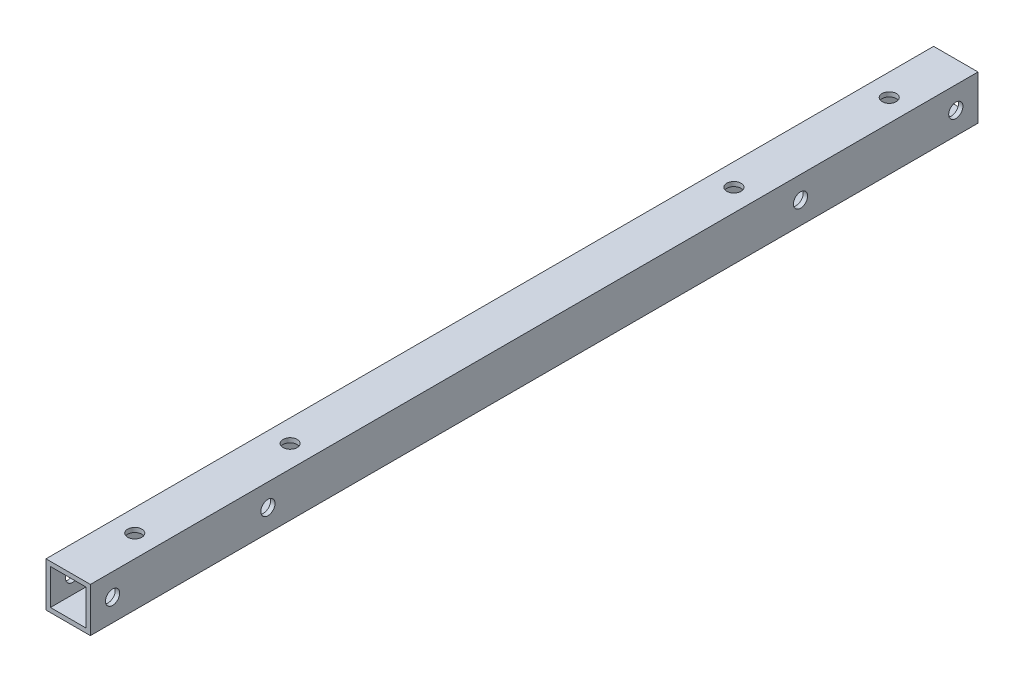
from build123d import *

# Parameters (mm, degrees)
SKETCH_1_W               = 10
SKETCH_1_H               = 10
SKETCH_1_W_2             = 8
SKETCH_1_H_2             = 8
EXTRUDE_1_DEPTH          = 200
CUT_EXTRUDE_1_DEPTH      = 201.31225624
CUT_EXTRUDE_1_DEPTH_BACK = 201.31225624
SKETCH_2_R               = 1.6
SKETCH_3_R               = 1.6
CUT_EXTRUDE_2_DEPTH      = 201.31225624
SKETCH_4_R               = 1.6
CUT_EXTRUDE_3_DEPTH      = 201.31225624


with BuildPart() as part:
    # ｽｹｯﾁ1 → ﾎﾞｽ - 押し出し1 (new body)
    with BuildSketch(Plane.XY):
        Rectangle(SKETCH_1_W, SKETCH_1_H)
        Rectangle(SKETCH_1_W_2, SKETCH_1_H_2, mode=Mode.SUBTRACT)
    extrude(amount=EXTRUDE_1_DEPTH)

    # ｽｹｯﾁ2 → ｶｯﾄ - 押し出し1 (cut, two sides: drawn at the far end of the back side and taken through both)
    with BuildSketch(Plane(origin=(5, 0, 0), x_dir=(0, 0, -1), z_dir=(1, 0, 0)).offset(-CUT_EXTRUDE_1_DEPTH_BACK)):
        with Locations(Location((-160, 0, 0), (0, 0, 90))):
            Circle(SKETCH_2_R)
        with Locations(Location((-40, 0, 0), (0, 0, 90))):
            Circle(SKETCH_2_R)
        with Locations(Location((-195, 0, 0), (0, 0, 90))):
            Circle(SKETCH_2_R)
        with Locations(Location((-5, 0, 0), (0, 0, 90))):
            Circle(SKETCH_2_R)
    extrude(amount=CUT_EXTRUDE_1_DEPTH + CUT_EXTRUDE_1_DEPTH_BACK, mode=Mode.SUBTRACT)

    # ｽｹｯﾁ3 → ｶｯﾄ - 押し出し2 (cut, through all)
    with BuildSketch(Plane(origin=(0, 5, 0), x_dir=(1, 0, 0), z_dir=(0, 1, 0))):
        with Locations(Location((0, -185, 0), (0, 0, 270))):
            Circle(SKETCH_3_R)
        with Locations(Location((0, -15, 0), (0, 0, 270))):
            Circle(SKETCH_3_R)
    extrude(amount=-CUT_EXTRUDE_2_DEPTH, mode=Mode.SUBTRACT)

    # ｽｹｯﾁ4 → ｶｯﾄ - 押し出し3 (cut, through all)
    with BuildSketch(Plane(origin=(0, 5, 0), x_dir=(1, 0, 0), z_dir=(0, 1, 0))):
        with Locations(Location((0, -50, 0), (0, 0, 270))):
            Circle(SKETCH_4_R)
        with Locations(Location((0, -150, 0), (0, 0, 270))):
            Circle(SKETCH_4_R)
    extrude(amount=-CUT_EXTRUDE_3_DEPTH, mode=Mode.SUBTRACT)


solid = part.part
